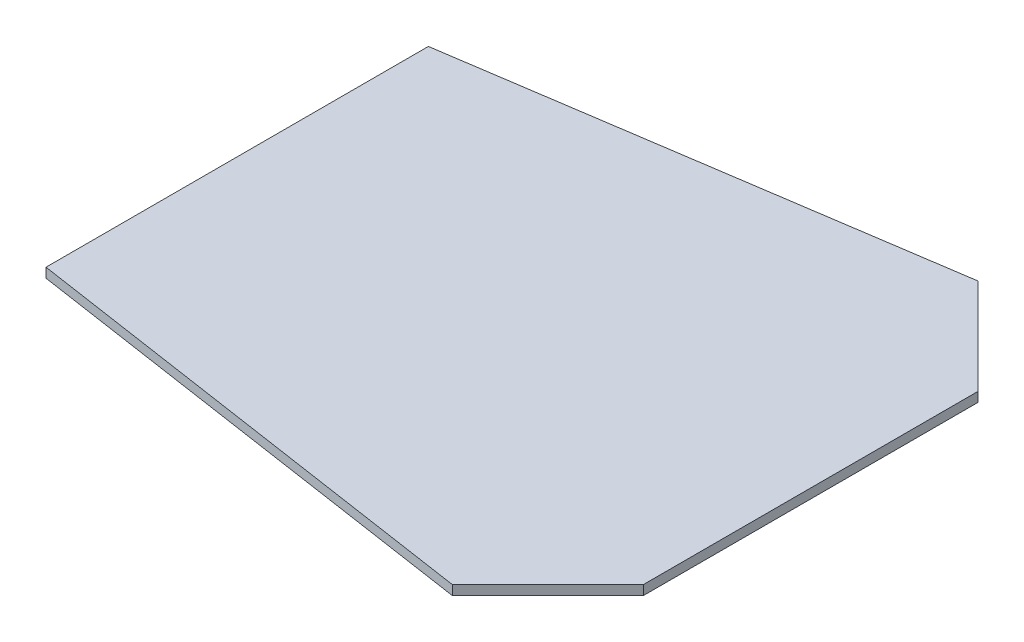
from build123d import *

# Parameters (mm, degrees)
BOSS_EXTRUDE1_DEPTH = 10


with BuildPart() as part:
    # Sketch1 → Boss-Extrude1 (new body)
    with BuildSketch(Plane(origin=(0, 0, 0), x_dir=(1, 0, 0), z_dir=(0, 1, 0))):
        Polygon((-59.885147031, 437.966242703), (-59.885147031, 37.966242703), (440.114852969, -37.033757297), (540.114852969, 62.966242703), (540.114852969, 412.966242703), (440.114852969, 512.966242703), align=None)
    extrude(amount=BOSS_EXTRUDE1_DEPTH)


solid = part.part
